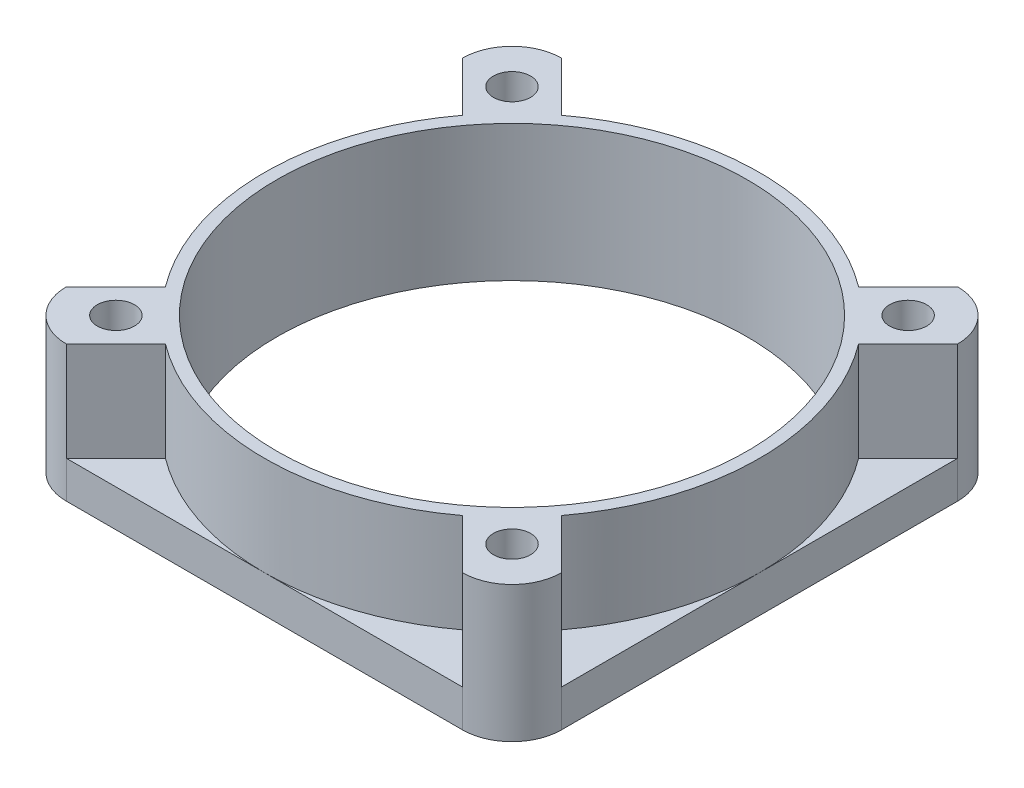
from build123d import *

# Parameters (mm, degrees)
SKETCH1_W           = 40
SKETCH1_H           = 40
BOSS_EXTRUDE1_DEPTH = 11
FILLET1_R           = 4
FILLET2_R           = 4
FILLET3_R           = 4
FILLET4_R           = 4
SKETCH2_R           = 19
CUT_EXTRUDE1_DEPTH  = 11
CUT_EXTRUDE2_DEPTH  = 8
SKETCH4_R           = 1.5
CUT_EXTRUDE3_DEPTH  = 11


with BuildPart() as part:
    # Sketch1 → Boss-Extrude1 (new body)
    with BuildSketch(Plane(origin=(0, 0, 0), x_dir=(1, 0, 0), z_dir=(0, 1, 0))):
        with Locations((20, 20)):
            Rectangle(SKETCH1_W, SKETCH1_H)
    extrude(amount=BOSS_EXTRUDE1_DEPTH)

    # Fillet1
    fillet1_edges = [part.edges().sort_by_distance(p)[0] for p in [
        (40, 5.5, 0),
    ]]
    fillet(fillet1_edges, radius=FILLET1_R)

    # Fillet2
    fillet2_edges = [part.edges().sort_by_distance(p)[0] for p in [
        (0, 5.5, 0),
    ]]
    fillet(fillet2_edges, radius=FILLET2_R)

    # Fillet3
    fillet3_edges = [part.edges().sort_by_distance(p)[0] for p in [
        (0, 5.5, -40),
    ]]
    fillet(fillet3_edges, radius=FILLET3_R)

    # Fillet4
    fillet4_edges = [part.edges().sort_by_distance(p)[0] for p in [
        (40, 5.5, -40),
    ]]
    fillet(fillet4_edges, radius=FILLET4_R)

    # Sketch2 → Cut-Extrude1 (cut)
    with BuildSketch(Plane(origin=(0, 11, 0), x_dir=(1, 0, 0), z_dir=(0, 1, 0))):
        with Locations(Location((20, 20, 0), (0, 0, 270))):
            Circle(SKETCH2_R)
    extrude(amount=-CUT_EXTRUDE1_DEPTH, mode=Mode.SUBTRACT)

    # Sketch3 → Cut-Extrude2 (cut)
    with BuildSketch(Plane(origin=(0, 11, 0), x_dir=(1, 0, 0), z_dir=(0, 1, 0))):
        with BuildLine():
            Line((4, 32), (0, 36))
            Line((0, 36), (0, 20))
            ThreePointArc((0, 20), (1.026334039, 26.32455532), (4, 32))
        make_face()
        with BuildLine():
            Line((4, 40), (8, 36))
            ThreePointArc((8, 36), (13.67544468, 38.973665961), (20, 40))
            Line((20, 40), (4, 40))
        make_face()
        with BuildLine():
            Line((36, 40), (20, 40))
            ThreePointArc((20, 40), (26.32455532, 38.973665961), (32, 36))
            Line((32, 36), (36, 40))
        make_face()
        with BuildLine():
            Line((40, 36), (36, 32))
            ThreePointArc((36, 32), (38.973665961, 26.32455532), (40, 20))
            Line((40, 20), (40, 36))
        make_face()
        with BuildLine():
            Line((40, 4), (40, 20))
            ThreePointArc((40, 20), (38.973665961, 13.67544468), (36, 8))
            Line((36, 8), (40, 4))
        make_face()
        with BuildLine():
            ThreePointArc((32, 4), (26.32455532, 1.026334039), (20, 0))
            Line((20, 0), (36, 0))
            Line((36, 0), (32, 4))
        make_face()
        with BuildLine():
            ThreePointArc((20, 0), (13.67544468, 1.026334039), (8, 4))
            Line((8, 4), (4, 0))
            Line((4, 0), (20, 0))
        make_face()
        with BuildLine():
            ThreePointArc((4, 8), (1.026334039, 13.67544468), (0, 20))
            Line((0, 20), (0, 4))
            Line((0, 4), (4, 8))
        make_face()
    extrude(amount=-CUT_EXTRUDE2_DEPTH, mode=Mode.SUBTRACT)

    # Sketch4 → Cut-Extrude3 (cut)
    with BuildSketch(Plane(origin=(0, 11, 0), x_dir=(1, 0, 0), z_dir=(0, 1, 0))):
        with Locations(Location((36, 36, 0), (0, 0, 270))):
            Circle(SKETCH4_R)
        with Locations(Location((4, 36, 0), (0, 0, 270))):
            Circle(SKETCH4_R)
        with Locations(Location((4, 4, 0), (0, 0, 270))):
            Circle(SKETCH4_R)
        with Locations(Location((36, 4, 0), (0, 0, 270))):
            Circle(SKETCH4_R)
    extrude(amount=-CUT_EXTRUDE3_DEPTH, mode=Mode.SUBTRACT)


solid = part.part
